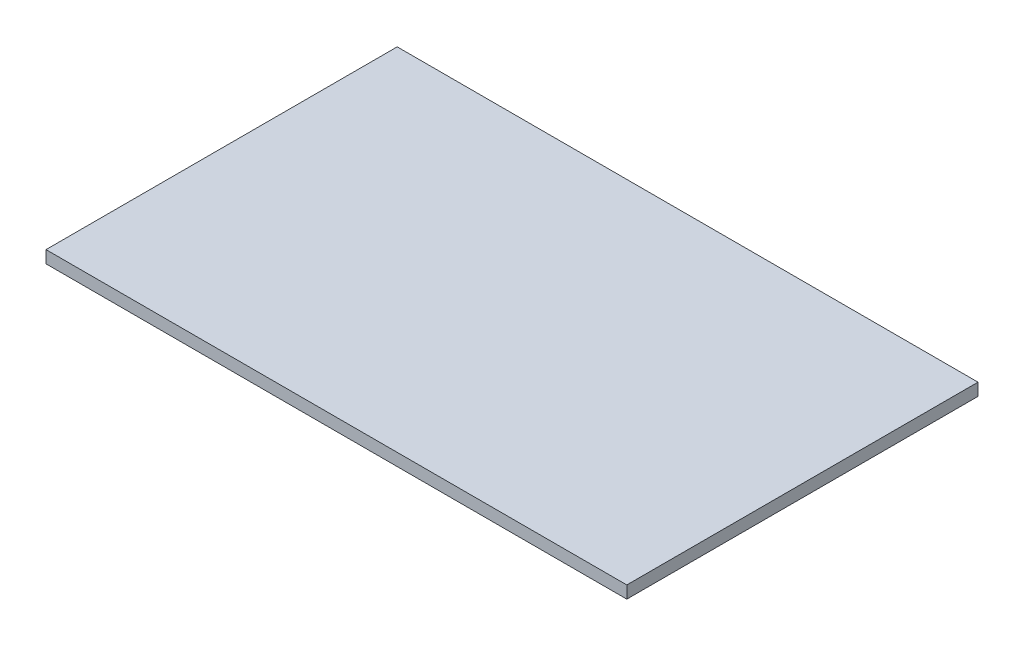
from build123d import *

# Parameters (mm, degrees)
SKETCH1_W           = 59.817
SKETCH1_H           = 36.1696
BOSS_EXTRUDE1_DEPTH = 1.27


with BuildPart() as part:
    # Sketch1 → Boss-Extrude1 (new body)
    with BuildSketch(Plane(origin=(0, 0, 0), x_dir=(1, 0, 0), z_dir=(0, 1, 0))):
        with Locations((29.9085, 18.0848)):
            Rectangle(SKETCH1_W, SKETCH1_H)
    extrude(amount=BOSS_EXTRUDE1_DEPTH)


solid = part.part
